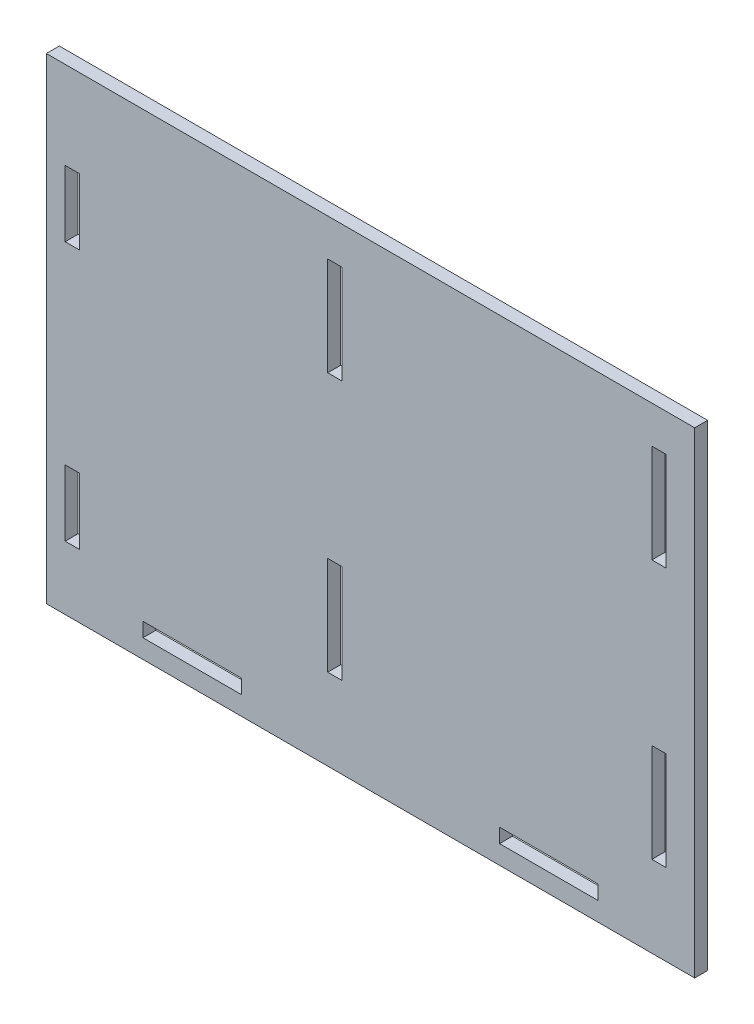
from build123d import *

# Parameters (mm, degrees)
SKETCH_1_W      = 200
SKETCH_1_H      = 147
SKETCH_1_W_2    = 4.4
SKETCH_1_H_2    = 20.4
SKETCH_1_W_3    = 30.4
SKETCH_1_H_3    = 4.4
SKETCH_1_H_4    = 30.4
EXTRUDE_1_DEPTH = 4


with BuildPart() as part:
    # Эскиз1 → Бобышка-Вытянуть1 (new body)
    with BuildSketch(Plane.XY):
        with Locations((100, 73.5)):
            Rectangle(SKETCH_1_W, SKETCH_1_H)
        with Locations((8, 29.8)):
            Rectangle(SKETCH_1_W_2, SKETCH_1_H_2, mode=Mode.SUBTRACT)
        with Locations((155, 8)):
            Rectangle(SKETCH_1_W_3, SKETCH_1_H_3, mode=Mode.SUBTRACT)
        with Locations((45, 8)):
            Rectangle(SKETCH_1_W_3, SKETCH_1_H_3, mode=Mode.SUBTRACT)
        with Locations((8, 109.8)):
            Rectangle(SKETCH_1_W_2, SKETCH_1_H_2, mode=Mode.SUBTRACT)
        with Locations((189, 40.3)):
            Rectangle(SKETCH_1_W_2, SKETCH_1_H_4, mode=Mode.SUBTRACT)
        with Locations((189, 120.3)):
            Rectangle(SKETCH_1_W_2, SKETCH_1_H_4, mode=Mode.SUBTRACT)
        with Locations((89, 120.3)):
            Rectangle(SKETCH_1_W_2, SKETCH_1_H_4, mode=Mode.SUBTRACT)
        with Locations((89, 40.3)):
            Rectangle(SKETCH_1_W_2, SKETCH_1_H_4, mode=Mode.SUBTRACT)
    extrude(amount=EXTRUDE_1_DEPTH)


solid = part.part
